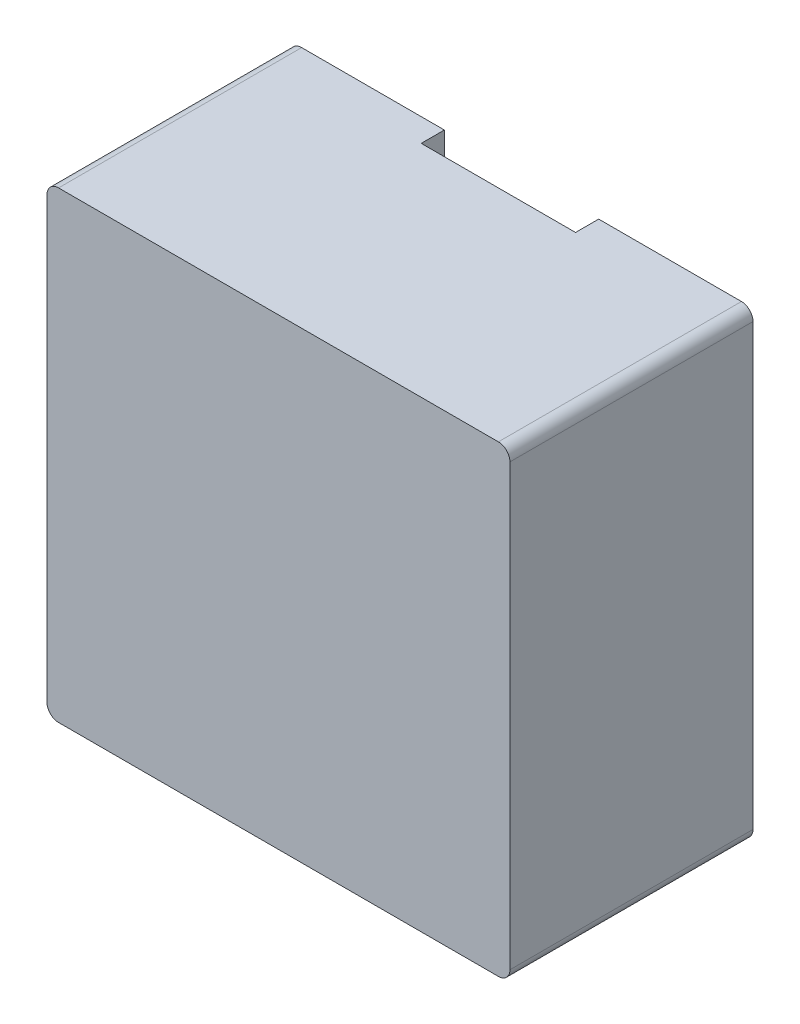
from build123d import *

# Parameters (mm, degrees)
SKETCH_1_W          = 6
SKETCH_1_H          = 6
EXTRUDE_1_DEPTH     = 3.15
SKETCH_2_W          = 2
SKETCH_2_H          = 0.3
CUT_EXTRUDE_1_DEPTH = 8.410971596
FILLET_1_R          = 0.15


with BuildPart() as part:
    # 草图1 → 凸台-拉伸1 (new body)
    with BuildSketch(Plane(origin=(0, 0, 0), x_dir=(-1, 0, 0), z_dir=(0, 0, -1))):
        Rectangle(SKETCH_1_W, SKETCH_1_H)
    extrude(amount=-EXTRUDE_1_DEPTH)

    # 草图2 → 切除-拉伸1 (cut, through all)
    with BuildSketch(Plane.XZ.offset(3)):
        with Locations((0, 0.15)):
            Rectangle(SKETCH_2_W, SKETCH_2_H)
    extrude(amount=-CUT_EXTRUDE_1_DEPTH, mode=Mode.SUBTRACT)

    # 圆角1
    fillet_1_edges = [part.edges().sort_by_distance(p)[0] for p in [
        (3, 3, 1.575),
        (-3, 3, 1.575),
        (-3, -3, 1.575),
        (3, -3, 1.575),
    ]]
    fillet(fillet_1_edges, radius=FILLET_1_R)


solid = part.part
